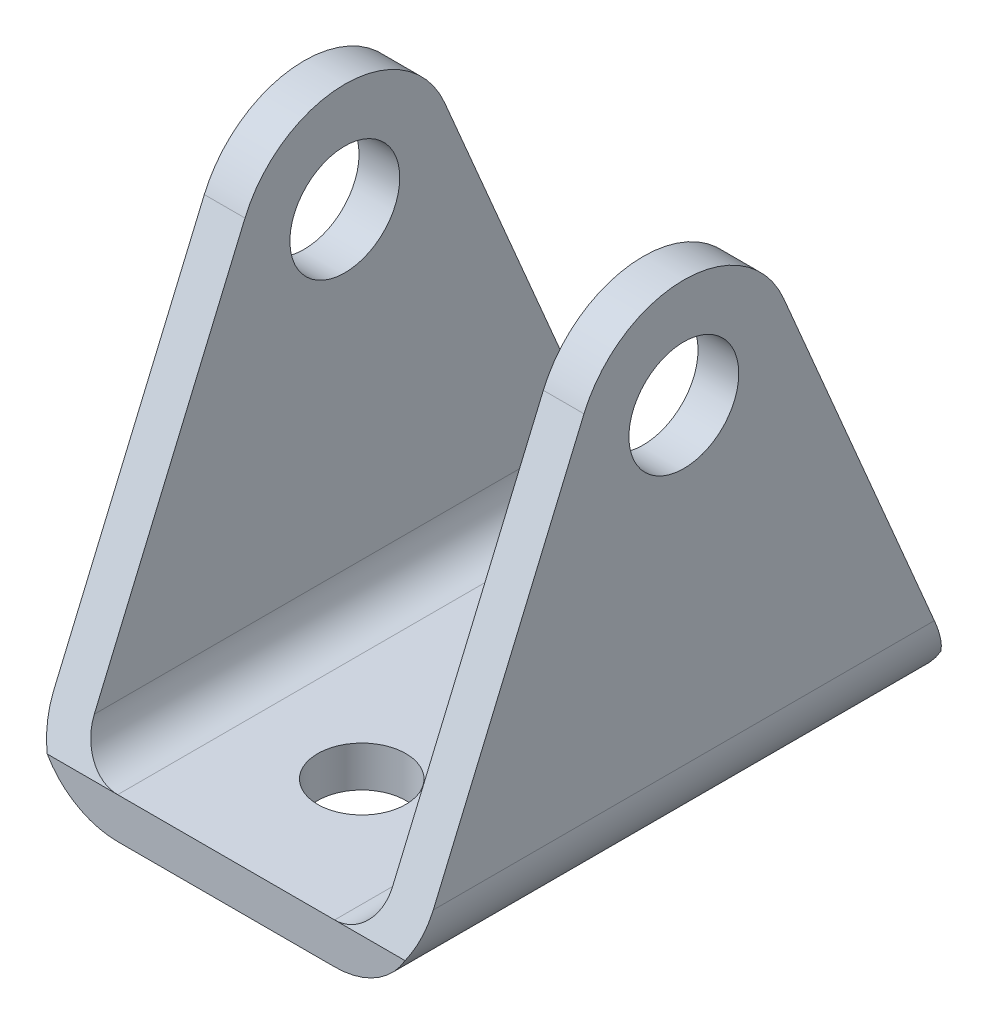
from build123d import *

# Parameters (mm, degrees)
SKETCH1_R           = 3.25
BOSS_EXTRUDE1_DEPTH = 3
SKETCH2_R           = 4.05
BOSS_EXTRUDE2_DEPTH = 3
FILLET1_R           = 6
FILLET2_R           = 3


with BuildPart() as part:
    # Sketch1 → Boss-Extrude1 (new body)
    with BuildSketch(Plane(origin=(0, 0, 0), x_dir=(1, 0, 0), z_dir=(0, 1, 0))):
        with BuildLine():
            Line((-11, -19.75), (11, -19.75))
            Line((11, -19.75), (11, 19.75))
            Line((11, 19.75), (4.25, 19.75))
            ThreePointArc((4.25, 19.75), (3.542893219, 19.457106781), (3.25, 18.75))
            Line((3.25, 18.75), (3.25, 12.25))
            ThreePointArc((3.25, 12.25), (0, 9), (-3.25, 12.25))
            Line((-3.25, 12.25), (-3.25, 18.75))
            ThreePointArc((-3.25, 18.75), (-3.542893219, 19.457106781), (-4.25, 19.75))
            Line((-4.25, 19.75), (-11, 19.75))
            Line((-11, 19.75), (-11, -19.75))
        make_face()
        with Locations(Location((0, -9.75, 0), (0, 0, 270))):
            Circle(SKETCH1_R, mode=Mode.SUBTRACT)
    extrude(amount=BOSS_EXTRUDE1_DEPTH)

    # Sketch2 → Boss-Extrude2 (add)
    with BuildSketch(Plane(origin=(11, 0, 0), x_dir=(0, 0, -1), z_dir=(1, 0, 0))):
        with BuildLine():
            Line((-19.75, 3), (-7.361967169, 32.130725061))
            ThreePointArc((-7.361967169, 32.130725061), (0, 37), (7.361967169, 32.130725061))
            Line((7.361967169, 32.130725061), (19.75, 3))
            Line((19.75, 3), (19.75, 0))
            Line((19.75, 0), (-19.75, 0))
            Line((-19.75, 0), (-19.75, 3))
        make_face()
        with Locations((0, 29)):
            Circle(SKETCH2_R, mode=Mode.SUBTRACT)
    boss_extrude2 = extrude(amount=BOSS_EXTRUDE2_DEPTH)

    # Mirror1: Boss-Extrude2 across plane
    add(boss_extrude2.mirror(Plane(origin=(0, 0, 0), x_dir=(0, 0, 1), z_dir=(1, 0, 0))))

    # Fillet1
    fillet1_edges = [part.edges().sort_by_distance(p)[0] for p in [
        (-14, 0, 0),
        (14, 0, 0),
    ]]
    fillet(fillet1_edges, radius=FILLET1_R)

    # Fillet2
    fillet2_edges = [part.edges().sort_by_distance(p)[0] for p in [
        (-11, 3, 0),
        (11, 3, 0),
    ]]
    fillet(fillet2_edges, radius=FILLET2_R)


solid = part.part
